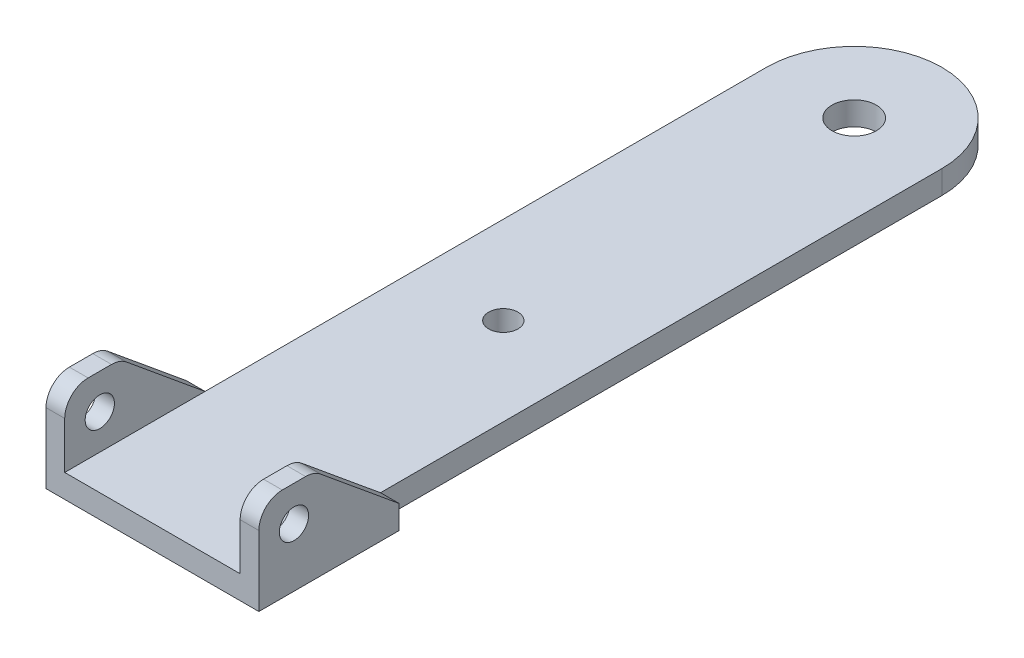
from build123d import *

# Parameters (mm, degrees)
SKETCH1_R           = 6.25
SKETCH1_R_2         = 9.5
BOSS_EXTRUDE1_DEPTH = 10
SKETCH4_R           = 6.25
BOSS_EXTRUDE3_DEPTH = 8


with BuildPart() as part:
    # Sketch1 → Boss-Extrude1 (new body)
    with BuildSketch(Plane(origin=(0, 0, 0), x_dir=(1, 0, 0), z_dir=(0, 1, 0))):
        with BuildLine():
            Line((-37.5, 0), (-37.5, -300))
            Line((-37.5, -300), (37.5, -300))
            Line((37.5, -300), (37.5, 0))
            ThreePointArc((37.5, 0), (0, 37.5), (-37.5, 0))
        make_face()
        with Locations(Location((0, -150, 0), (0, 0, 270))):
            Circle(SKETCH1_R, mode=Mode.SUBTRACT)
        with Locations(Location((0, 0, 0), (0, 0, 270))):
            Circle(SKETCH1_R_2, mode=Mode.SUBTRACT)
    extrude(amount=BOSS_EXTRUDE1_DEPTH)

    # Sketch4 → Boss-Extrude3 (add)
    with BuildSketch(Plane(origin=(37.5, 0, 0), x_dir=(0, 0, -1), z_dir=(1, 0, 0))):
        with BuildLine():
            Line((-240, 0), (-240, 10))
            Line((-240, 10), (-273.641101056, 37.717797887))
            ThreePointArc((-273.641101056, 37.717797887), (-276.621981266, 39.412172408), (-280, 40))
            Line((-280, 40), (-290, 40))
            ThreePointArc((-290, 40), (-297.071067812, 37.071067812), (-300, 30))
            Line((-300, 30), (-300, 0))
            Line((-300, 0), (-240, 0))
        make_face()
        with Locations((-285, 25)):
            Circle(SKETCH4_R, mode=Mode.SUBTRACT)
    boss_extrude3 = extrude(amount=BOSS_EXTRUDE3_DEPTH)

    # Mirror1: Boss-Extrude3 across plane
    add(boss_extrude3.mirror(Plane(origin=(0, 0, 0), x_dir=(0, 0, 1), z_dir=(1, 0, 0))))


solid = part.part
